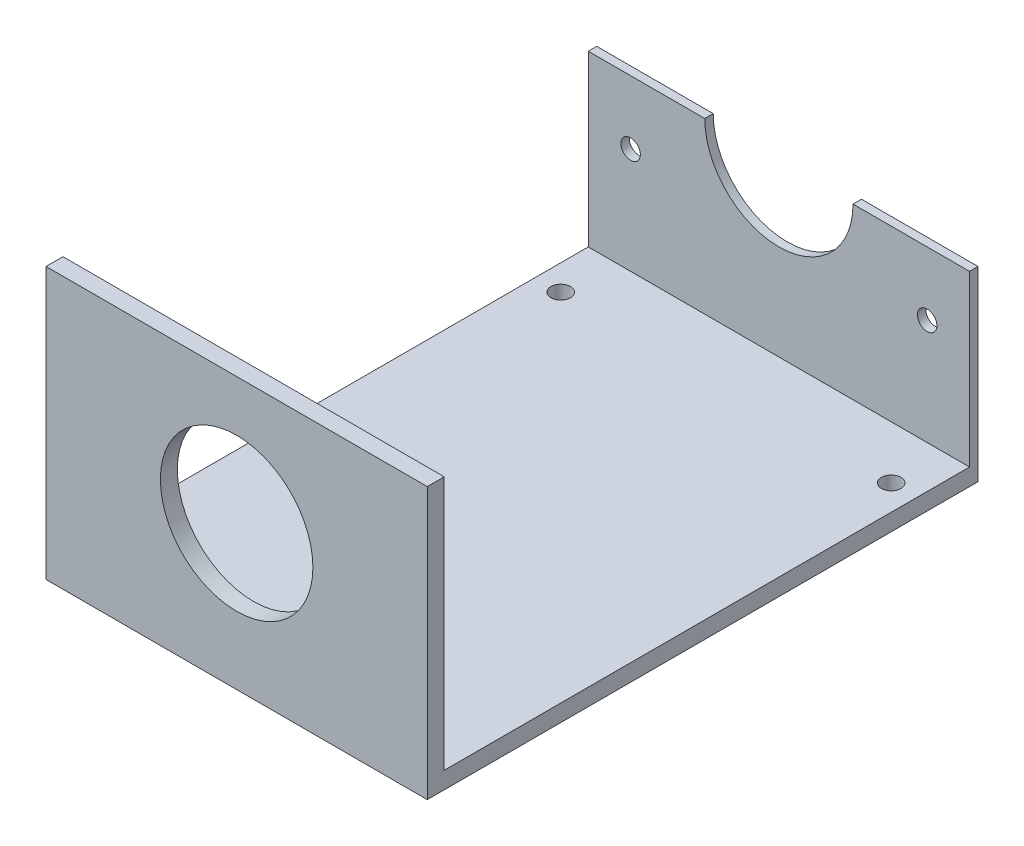
from build123d import *

# Parameters (mm, degrees)
SKETCH1_R           = 2.3
BOSS_EXTRUDE1_DEPTH = 2
SKETCH2_W           = 90
SKETCH2_H           = 4
BOSS_EXTRUDE2_DEPTH = 128
SKETCH3_W           = 90
SKETCH3_H           = 4
BOSS_EXTRUDE3_DEPTH = 60
SKETCH4_R           = 18
CUT_EXTRUDE1_DEPTH  = 60
SKETCH5_R           = 2.3
CUT_EXTRUDE2_DEPTH  = 60


with BuildPart() as part:
    # Sketch1 → Boss-Extrude1 (new body)
    with BuildSketch(Plane.XY):
        with BuildLine():
            Line((0, 0), (0, 40))
            Line((0, 40), (27.5, 40))
            ThreePointArc((27.5, 40), (45, 22.5), (62.5, 40))
            Line((62.5, 40), (90, 40))
            Line((90, 40), (90, 0))
            Line((90, 0), (90, -4))
            Line((90, -4), (0, -4))
            Line((0, -4), (0, 0))
        make_face()
        with Locations((10, 25)):
            Circle(SKETCH1_R, mode=Mode.SUBTRACT)
        with Locations((80, 25)):
            Circle(SKETCH1_R, mode=Mode.SUBTRACT)
    extrude(amount=-BOSS_EXTRUDE1_DEPTH)

    # Sketch2 → Boss-Extrude2 (add)
    with BuildSketch(Plane.XY):
        with Locations((45, -2)):
            Rectangle(SKETCH2_W, SKETCH2_H)
    extrude(amount=BOSS_EXTRUDE2_DEPTH)

    # Sketch3 → Boss-Extrude3 (add)
    with BuildSketch(Plane(origin=(0, 0, 0), x_dir=(1, 0, 0), z_dir=(0, 1, 0))):
        with Locations((45, -126)):
            Rectangle(SKETCH3_W, SKETCH3_H)
    extrude(amount=BOSS_EXTRUDE3_DEPTH)

    # Sketch4 → Cut-Extrude1 (cut)
    with BuildSketch(Plane.XY.offset(128)):
        with Locations((45, 30)):
            Circle(SKETCH4_R)
    extrude(amount=-CUT_EXTRUDE1_DEPTH, mode=Mode.SUBTRACT)

    # Sketch5 → Cut-Extrude2 (cut)
    with BuildSketch(Plane(origin=(0, 0, 0), x_dir=(1, 0, 0), z_dir=(0, 1, 0))):
        with Locations(Location((6, -12.5, 0), (0, 0, 270))):
            Circle(SKETCH5_R)
        with Locations(Location((84, -12.5, 0), (0, 0, 270))):
            Circle(SKETCH5_R)
    extrude(amount=-CUT_EXTRUDE2_DEPTH, mode=Mode.SUBTRACT)


solid = part.part
